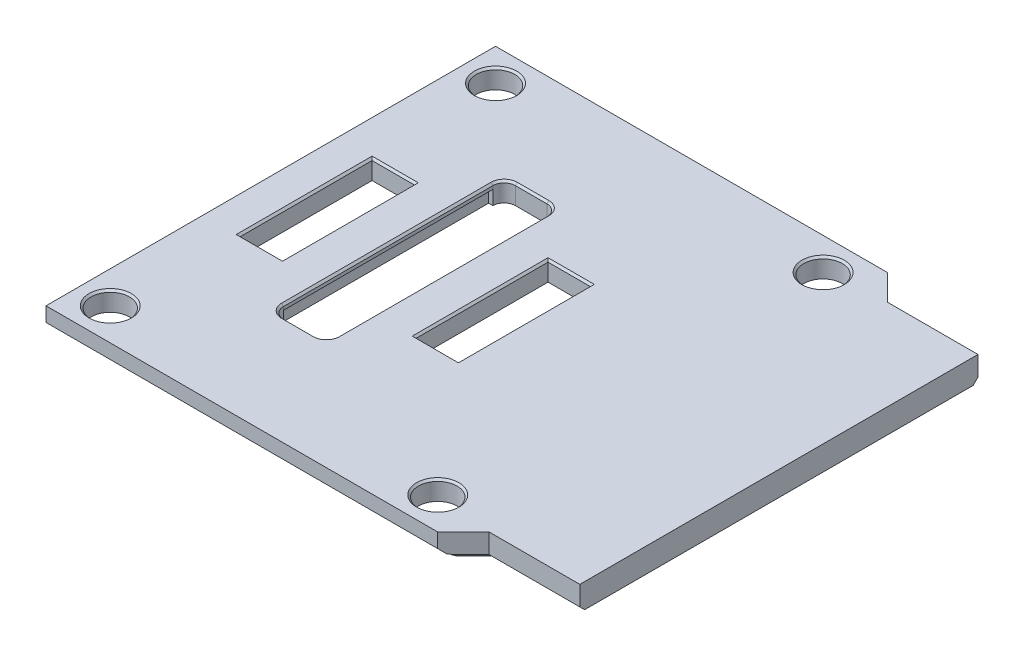
from build123d import *

# Parameters (mm, degrees)
SKETCH21_R          = 3
SKETCH21_W          = 6.6
SKETCH21_H          = 20.55
BOSS_EXTRUDE3_DEPTH = 3
BOSS_EXTRUDE2_DEPTH = 0.8
CUT_EXTRUDE1_DEPTH  = 2.2
CUT_EXTRUDE2_DEPTH  = 1
CHAMFER1_SIZE       = 0.3
CHAMFER2_SIZE       = 0.75


with BuildPart() as part:
    # Sketch21 → Boss-Extrude3 (new body)
    with BuildSketch(Plane(origin=(0, 0, 0), x_dir=(1, 0, 0), z_dir=(0, 1, 0))):
        Polygon((38.5, 35), (-22.5, 35), (-22.5, -35), (38.5, -35), (42.5, -31), (56.625, -31), (56.625, 31), (42.5, 31), align=None)
        with Locations(Location((-17.5, 30, 0), (0, 0, 270))):
            Circle(SKETCH21_R, mode=Mode.SUBTRACT)
        with Locations(Location((-17.5, -30, 0), (0, 0, 270))):
            Circle(SKETCH21_R, mode=Mode.SUBTRACT)
        with Locations(Location((33.5, -30, 0), (0, 0, 270))):
            Circle(SKETCH21_R, mode=Mode.SUBTRACT)
        with Locations(Location((33.5, 30, 0), (0, 0, 270))):
            Circle(SKETCH21_R, mode=Mode.SUBTRACT)
        with Locations((-13.7, 0)):
            Rectangle(SKETCH21_W, SKETCH21_H, mode=Mode.SUBTRACT)
        with BuildLine():
            Line((-4.21, 16.3), (-4.21, -16.3))
            ThreePointArc((-4.21, -16.3), (-3.697436867, -17.537436867), (-2.46, -18.05))
            Line((-2.46, -18.05), (2.46, -18.05))
            ThreePointArc((2.46, -18.05), (3.697436867, -17.537436867), (4.21, -16.3))
            Line((4.21, -16.3), (4.21, 16.3))
            ThreePointArc((4.21, 16.3), (3.697436867, 17.537436867), (2.46, 18.05))
            Line((2.46, 18.05), (-2.46, 18.05))
            ThreePointArc((-2.46, 18.05), (-3.697436867, 17.537436867), (-4.21, 16.3))
        make_face(mode=Mode.SUBTRACT)
        with Locations((13.7, 0)):
            Rectangle(SKETCH21_W, SKETCH21_H, mode=Mode.SUBTRACT)
    extrude(amount=BOSS_EXTRUDE3_DEPTH)

    # Sketch28 → Boss-Extrude2 (add)
    with BuildSketch(Plane.XZ):
        Polygon((39.5, 34), (39.5, -34), (42.5, -31), (56.625, -31), (56.625, 31), (42.5, 31), align=None)
    extrude(amount=BOSS_EXTRUDE2_DEPTH)

    # Sketch29 → Cut-Extrude1 (cut)
    with BuildSketch(Plane.XZ):
        Polygon((-4.21, 16.3), (-4.875, 16.3), (-4.875, -16.3), (-4.21, -16.3), (4.21, -16.3), (4.875, -16.3), (4.875, 16.3), (4.21, 16.3), align=None)
    extrude(amount=-CUT_EXTRUDE1_DEPTH, mode=Mode.SUBTRACT)

    # Sketch30 → Cut-Extrude2 (cut)
    # profile 1 of 4: a face of its own
    with BuildSketch(Plane.XZ):
        Polygon((30, -6.084415584), (30, -7.123376623), (23.194805195, -7.123376623), (30, -9.358766234), (30, -10.290584416), (23.194805195, -12.525974026), (30, -12.525974026), (30, -13.564935065), (22, -13.564935065), (22, -11.939935065), (28.668831169, -9.829545455), (22, -7.709415584), (22, -6.084415584), align=None)
    # profile 2 of 4: a face of its own
    with BuildSketch(Plane.XZ):
        with BuildLine():
            add(Edge.make_bspline(
                [(30.103896104, -2.298701299), (30.103067309, -2.395623244), (30.101458149, -2.583803562), (30.077120757, -2.856806977), (30.043441513, -3.112684332), (29.990720477, -3.349454628), (29.92681865, -3.569556735), (29.84494459, -3.770560491), (29.751676383, -3.9562646), (29.640184851, -4.121871579), (29.516615752, -4.272075178), (29.375879847, -4.401668661), (29.221972567, -4.515692158), (29.052257996, -4.609156913), (28.868514081, -4.686592109), (28.670085387, -4.743928609), (28.457107647, -4.785605452), (28.309709631, -4.797462408), (28.233766234, -4.803571429)],
                knots=[0, 0, 0, 0, 1.318794478, 2.560526035, 3.728243692, 4.829167506, 5.859211314, 6.844017696, 7.77958115, 8.682536498, 9.55583357, 10.420985288, 11.279874663, 12.156984126, 13.05163966, 13.988564904, 14.963654886, 16, 16, 16, 16], degree=3))
            Line((28.233766234, -4.803571429), (28.233766234, -3.76461039))
            add(Edge.make_bspline(
                [(28.233766234, -3.76461039), (28.276082816, -3.763564761), (28.357947694, -3.761541907), (28.476134337, -3.740166384), (28.586751637, -3.712672627), (28.688349357, -3.67036585), (28.783864525, -3.621500377), (28.868666466, -3.555998852), (28.946860594, -3.482137003), (29.015350514, -3.395594265), (29.078413582, -3.299861025), (29.128391442, -3.189971645), (29.17548457, -3.07144951), (29.209220227, -2.940779669), (29.240159157, -2.800318747), (29.257500765, -2.647495072), (29.271994968, -2.484042329), (29.272478757, -2.371250975), (29.272727273, -2.313311688)],
                knots=[0, 0, 0, 0, 1.000573209, 1.935690443, 2.836843993, 3.693268586, 4.535782358, 5.368499125, 6.220215677, 7.076544447, 7.975601122, 8.926814499, 9.928453325, 10.991382637, 12.117004715, 13.331014315, 14.628980654, 16, 16, 16, 16], degree=3))
            add(Edge.make_bspline(
                [(29.272727273, -2.313311688), (29.272477286, -2.261323175), (29.271992064, -2.160413873), (29.25754424, -2.01369465), (29.239472891, -1.876258483), (29.21132631, -1.748275466), (29.176555316, -1.630075024), (29.131923796, -1.521611339), (29.080501402, -1.422166793), (29.001941506, -1.306296479), (28.891278773, -1.182718379), (28.73659228, -1.072587187), (28.562614518, -1.00468464), (28.440535545, -0.997283039), (28.378246753, -0.993506494)],
                knots=[0, 0, 0, 0, 1.049722362, 2.037502948, 2.975957546, 3.848689641, 4.682196446, 5.461765277, 6.214820971, 6.939488855, 8.285974658, 9.541612251, 10.745648019, 12, 12, 12, 12], degree=3))
            add(Edge.make_bspline(
                [(28.378246753, -0.993506494), (28.346763417, -0.994183282), (28.285509435, -0.995500043), (28.198094752, -1.013038493), (28.116989153, -1.036078954), (28.043895516, -1.073277175), (27.978132386, -1.120152847), (27.91781187, -1.175968403), (27.867975971, -1.243948686), (27.822461309, -1.322779364), (27.783044583, -1.418968765), (27.736245211, -1.532239323), (27.690729471, -1.668941517), (27.640192756, -1.826342557), (27.586743359, -2.005529733), (27.52981461, -2.206135721), (27.472099938, -2.429578583), (27.410484723, -2.667825675), (27.348547139, -2.908916775), (27.281606559, -3.138344652), (27.213843382, -3.35068402), (27.144538665, -3.546605107), (27.071027512, -3.724150567), (26.999273376, -3.886230737), (26.921988655, -4.029162978), (26.844897165, -4.158210405), (26.757806858, -4.271639817), (26.655650322, -4.368805026), (26.538272332, -4.449974022), (26.405573224, -4.515399248), (26.259022178, -4.567101625), (26.096859779, -4.604654298), (25.919870357, -4.624614358), (25.797123614, -4.628080852), (25.733766234, -4.62987013)],
                knots=[0, 0, 0, 0, 0.609469888, 1.185784659, 1.72354831, 2.239788445, 2.766795736, 3.28643782, 3.825837257, 4.394650866, 5.047817349, 5.838989728, 6.771546224, 7.840191231, 9.04536596, 10.397473415, 11.883969141, 13.520573579, 15.169980156, 16.710930355, 18.154580726, 19.492276644, 20.739482987, 21.88068629, 22.927624582, 23.888735019, 24.79347993, 25.691627909, 26.611521855, 27.550140283, 28.552530272, 29.619112255, 30.771072804, 32, 32, 32, 32], degree=3))
            add(Edge.make_bspline(
                [(25.733766234, -4.62987013), (25.67520802, -4.627970482), (25.560134212, -4.62423745), (25.391367911, -4.595537471), (25.230466456, -4.550698077), (25.077097455, -4.486528081), (24.932327589, -4.402583067), (24.793763605, -4.302331737), (24.665049855, -4.181655436), (24.543482, -4.046039193), (24.43312437, -3.894260688), (24.339684079, -3.727132066), (24.257615927, -3.549505201), (24.190985373, -3.359321562), (24.141623211, -3.156271887), (24.103560771, -2.942230454), (24.083220864, -2.715216877), (24.079718791, -2.560100694), (24.077922078, -2.480519481)],
                knots=[0, 0, 0, 0, 0.925490325, 1.81869781, 2.698985002, 3.561843198, 4.439506826, 5.339694674, 6.260029024, 7.223537863, 8.216200057, 9.220155366, 10.24621711, 11.306974059, 12.400590692, 13.547020494, 14.741516967, 16, 16, 16, 16], degree=3))
            add(Edge.make_bspline(
                [(24.077922078, -2.480519481), (24.079100785, -2.389033894), (24.081391296, -2.211255453), (24.100967879, -1.95323672), (24.133116756, -1.711952726), (24.17768197, -1.488210503), (24.236413566, -1.281944584), (24.307185153, -1.093035368), (24.392098481, -0.921208329), (24.489260392, -0.766089492), (24.600165531, -0.628414151), (24.72493983, -0.508947344), (24.86185203, -0.405701135), (25.012592849, -0.320870627), (25.17622274, -0.25389912), (25.353001809, -0.206065737), (25.542097394, -0.172474188), (25.673013023, -0.165777509), (25.74025974, -0.162337662)],
                knots=[0, 0, 0, 0, 1.35942475, 2.641688414, 3.842675212, 4.97503988, 6.028837698, 7.026524857, 7.968775207, 8.872346758, 9.741443809, 10.588878301, 11.433254833, 12.283089724, 13.152223979, 14.05361, 15.000208458, 16, 16, 16, 16], degree=3))
            Line((25.74025974, -0.162337662), (25.74025974, -1.201298701))
            add(Edge.make_bspline(
                [(25.74025974, -1.201298701), (25.674721832, -1.208715551), (25.549076856, -1.222934647), (25.375375364, -1.289794963), (25.22801032, -1.391278982), (25.108112126, -1.529254824), (25.017480494, -1.70236831), (24.95378105, -1.908593969), (24.915339674, -2.147931329), (24.911256881, -2.318566714), (24.909090909, -2.409090909)],
                knots=[0, 0, 0, 0, 0.958885329, 1.838312007, 2.683388096, 3.544636038, 4.476874501, 5.512704297, 6.680458674, 8, 8, 8, 8], degree=3))
            add(Edge.make_bspline(
                [(24.909090909, -2.409090909), (24.910895743, -2.490953805), (24.914357274, -2.647960509), (24.950990134, -2.872453696), (25.008423519, -3.075331214), (25.076523787, -3.227354018), (25.141975259, -3.334516311), (25.197828471, -3.402415345), (25.256998255, -3.462751797), (25.325503304, -3.506899846), (25.395422474, -3.546527148), (25.472769579, -3.571306954), (25.554938786, -3.588887883), (25.61190975, -3.590222262), (25.641233766, -3.590909091)],
                knots=[0, 0, 0, 0, 1.898886608, 3.641917703, 5.263913708, 6.781775949, 7.492829293, 8.171637923, 8.820129793, 9.443813489, 10.056392137, 10.680075833, 11.320610447, 12, 12, 12, 12], degree=3))
            add(Edge.make_bspline(
                [(25.641233766, -3.590909091), (25.693601745, -3.588173991), (25.793343993, -3.582964606), (25.932521067, -3.532755637), (26.046460672, -3.446847813), (26.120477608, -3.347186421), (26.16971367, -3.244863761), (26.211505197, -3.142238609), (26.256566207, -3.015362815), (26.304827388, -2.864194696), (26.357408524, -2.688599575), (26.409102043, -2.487553747), (26.469062821, -2.262972788), (26.527292162, -2.019674479), (26.590317686, -1.7725332), (26.656464534, -1.535158817), (26.725715485, -1.314577671), (26.79891335, -1.111735187), (26.873636009, -0.925204125), (26.951004783, -0.755596696), (27.03015641, -0.602152272), (27.113523202, -0.464723076), (27.205414194, -0.342175865), (27.315001132, -0.238929071), (27.438169167, -0.150181539), (27.576625602, -0.076808805), (27.731509238, -0.021618552), (27.901145757, 0.016112898), (28.08529053, 0.041358551), (28.213113542, 0.044058296), (28.279220779, 0.045454545)],
                knots=[0, 0, 0, 0, 0.886876726, 1.689182582, 2.470212093, 3.276978007, 3.770089089, 4.396329915, 5.157818963, 6.055717916, 7.090729244, 8.269771542, 9.580232216, 11.037716353, 12.51750611, 13.910932755, 15.221554488, 16.442288017, 17.571848501, 18.632682187, 19.606715272, 20.501836021, 21.360120455, 22.198499933, 23.047686038, 23.931415603, 24.849906235, 25.830634081, 26.878051879, 28, 28, 28, 28], degree=3))
            add(Edge.make_bspline(
                [(28.279220779, 0.045454545), (28.34371882, 0.043630808), (28.470156379, 0.040055678), (28.655638898, 0.010463378), (28.832279264, -0.040858624), (29.001301578, -0.109714297), (29.160557988, -0.201265786), (29.312612514, -0.310219714), (29.455421384, -0.440819067), (29.587891688, -0.590437305), (29.709455888, -0.755056432), (29.815732766, -0.934994432), (29.904732119, -1.128858396), (29.978152624, -1.336386007), (30.034513409, -1.557599571), (30.074835203, -1.792625486), (30.099493407, -2.041138559), (30.10240589, -2.211522119), (30.103896104, -2.298701299)],
                knots=[0, 0, 0, 0, 0.930697296, 1.824475469, 2.702134557, 3.581182897, 4.452177757, 5.347490549, 6.276448989, 7.239081344, 8.228006388, 9.226020669, 10.250015029, 11.302452558, 12.399371731, 13.540990107, 14.741812496, 16, 16, 16, 16], degree=3))
        make_face()
    # profile 3 of 4: a face of its own
    with BuildSketch(Plane.XZ):
        with BuildLine():
            add(Edge.make_bspline(
                [(25.196428571, 2.332792208), (25.157055554, 2.382974774), (25.078640032, 2.482918653), (24.977939773, 2.645173305), (24.891152156, 2.815904453), (24.821831827, 2.996168251), (24.768019094, 3.184764495), (24.728848381, 3.381766925), (24.706249319, 3.588216661), (24.702967117, 3.728841786), (24.701298701, 3.800324675)],
                knots=[0, 0, 0, 0, 0.967432277, 1.926743552, 2.892675798, 3.870267945, 4.852814835, 5.865879806, 6.915179084, 8, 8, 8, 8], degree=3))
            add(Edge.make_bspline(
                [(24.701298701, 3.800324675), (24.703563129, 3.881058436), (24.708034569, 4.04047894), (24.741230486, 4.276028237), (24.796337503, 4.5032459), (24.873266474, 4.723087096), (24.972440607, 4.934018085), (25.093888362, 5.137266498), (25.237518365, 5.331740896), (25.399769086, 5.518271099), (25.582764557, 5.687001357), (25.779346309, 5.839032321), (25.994038689, 5.962802723), (26.220737112, 6.068995757), (26.463759575, 6.147305669), (26.720761753, 6.204418965), (26.992029884, 6.238872465), (27.177930141, 6.243016619), (27.272727273, 6.24512987)],
                knots=[0, 0, 0, 0, 0.976972944, 1.929174593, 2.872777695, 3.80284985, 4.743379281, 5.689162028, 6.663805022, 7.666263974, 8.676566079, 9.672133131, 10.667376965, 11.669643332, 12.696956219, 13.750492063, 14.852896154, 16, 16, 16, 16], degree=3))
            add(Edge.make_bspline(
                [(27.272727273, 6.24512987), (27.372384544, 6.242968161), (27.56851036, 6.23871391), (27.856081497, 6.20458936), (28.130345661, 6.145831052), (28.391358065, 6.064675449), (28.6392502, 5.960290907), (28.874731804, 5.833380633), (29.095915293, 5.681164818), (29.303241216, 5.508560749), (29.49094159, 5.315978982), (29.656107564, 5.107601247), (29.795515208, 4.88343808), (29.907747413, 4.642787034), (29.995291092, 4.38689167), (30.05873332, 4.116183806), (30.096457588, 3.830068071), (30.101377297, 3.634313772), (30.103896104, 3.534090909)],
                knots=[0, 0, 0, 0, 1.085861201, 2.136978174, 3.150190858, 4.138733941, 5.111317432, 6.077083246, 7.048682929, 8.032518342, 9.012528758, 9.974054186, 10.924831911, 11.88246139, 12.861548741, 13.867130159, 14.908007008, 16, 16, 16, 16], degree=3))
            add(Edge.make_bspline(
                [(30.103896104, 3.534090909), (30.101751534, 3.451787378), (30.097522312, 3.289479878), (30.072245084, 3.050299943), (30.025485968, 2.820575556), (29.965123269, 2.598800204), (29.883110281, 2.387188976), (29.783482599, 2.184693669), (29.666344126, 1.99120498), (29.532309413, 1.807585193), (29.379678975, 1.638685125), (29.209492939, 1.485954449), (29.021142247, 1.352793472), (28.814111947, 1.240408433), (28.590536057, 1.146160265), (28.349344421, 1.069962076), (28.090196015, 1.012558983), (27.910420049, 0.991383866), (27.818181818, 0.980519481)],
                knots=[0, 0, 0, 0, 1.037667412, 2.046342376, 3.026947607, 3.99019774, 4.940315345, 5.882984018, 6.831753852, 7.788168383, 8.744436945, 9.696144912, 10.665174598, 11.645115268, 12.659953086, 13.719211991, 14.829788793, 16, 16, 16, 16], degree=3))
            Line((27.818181818, 0.980519481), (27.818181818, 2.019480519))
            add(Edge.make_bspline(
                [(27.818181818, 2.019480519), (27.877850113, 2.027849738), (27.994093999, 2.044154385), (28.161186309, 2.081705555), (28.316907726, 2.128212171), (28.459962909, 2.187263598), (28.592524549, 2.254572669), (28.711542941, 2.335200648), (28.819521904, 2.424657487), (28.915394841, 2.524134003), (28.999906491, 2.631495375), (29.072914947, 2.74531682), (29.13496845, 2.864272867), (29.185432947, 2.988199815), (29.224707235, 3.116982335), (29.25163716, 3.25132011), (29.270917151, 3.390677608), (29.272118544, 3.485862248), (29.272727273, 3.534090909)],
                knots=[0, 0, 0, 0, 1.241156875, 2.417982611, 3.525572816, 4.58578494, 5.60320588, 6.583594582, 7.541596003, 8.487909663, 9.424847767, 10.352784656, 11.270481184, 12.185735582, 13.106408138, 14.04022233, 15.007009384, 16, 16, 16, 16], degree=3))
            add(Edge.make_bspline(
                [(29.272727273, 3.534090909), (29.271339843, 3.594791616), (29.26861352, 3.714069589), (29.242077028, 3.888335719), (29.198214168, 4.053943445), (29.136195344, 4.210105321), (29.057577844, 4.357887375), (28.961437073, 4.49654939), (28.84632936, 4.625488416), (28.715397616, 4.744687878), (28.571978869, 4.852066576), (28.42000248, 4.947879936), (28.258332779, 5.026622934), (28.08957943, 5.094284443), (27.911447154, 5.144236212), (27.725620634, 5.179170243), (27.532025877, 5.203520656), (27.399969394, 5.205275925), (27.332792208, 5.206168831)],
                knots=[0, 0, 0, 0, 1.016080181, 1.996615692, 2.944134192, 3.879876401, 4.804314401, 5.742073392, 6.698693939, 7.693038145, 8.702671078, 9.696023502, 10.697159615, 11.71032537, 12.737380959, 13.789639752, 14.875588847, 16, 16, 16, 16], degree=3))
            add(Edge.make_bspline(
                [(27.332792208, 5.206168831), (27.265072376, 5.20529079), (27.132471854, 5.203571519), (26.939401041, 5.179356903), (26.757134743, 5.144952202), (26.585698717, 5.094040967), (26.426011136, 5.027730354), (26.27651617, 4.947917204), (26.139117332, 4.852690989), (26.01314256, 4.744217982), (25.89901073, 4.62471489), (25.802122889, 4.493971041), (25.717898464, 4.356463002), (25.649134521, 4.209676474), (25.598049532, 4.053473252), (25.560283269, 3.889440266), (25.537293176, 3.717097773), (25.534096567, 3.599096205), (25.532467532, 3.538961039)],
                knots=[0, 0, 0, 0, 1.174140589, 2.299055552, 3.37064078, 4.389478889, 5.395475724, 6.365793819, 7.324138425, 8.289493223, 9.245812312, 10.184644224, 11.107234683, 12.039660683, 12.989691782, 13.953035803, 14.95683987, 16, 16, 16, 16], degree=3))
            add(Edge.make_bspline(
                [(25.532467532, 3.538961039), (25.53458077, 3.469552279), (25.538751008, 3.332581883), (25.57403365, 3.131482346), (25.630870364, 2.938500675), (25.711180045, 2.753776927), (25.814317042, 2.577332966), (25.940571394, 2.409546562), (26.088781471, 2.24915104), (26.201855833, 2.15307754), (26.25974026, 2.103896104)],
                knots=[0, 0, 0, 0, 0.998714719, 1.970851397, 2.929755122, 3.889323247, 4.86342469, 5.865325013, 6.907228509, 8, 8, 8, 8], degree=3))
            Line((26.25974026, 2.103896104), (26.25974026, 1.292207792))
            Line((26.25974026, 1.292207792), (22, 1.603896104))
            Line((22, 1.603896104), (22, 5.863636364))
            Line((22, 5.863636364), (22.935064935, 5.863636364))
            Line((22.935064935, 5.863636364), (22.935064935, 2.5))
            Line((22.935064935, 2.5), (25.196428571, 2.332792208))
        make_face()
    # profile 4 of 4: a face of its own
    with BuildSketch(Plane.XZ):
        with BuildLine():
            add(Edge.make_bspline(
                [(24.878246753, 8.461038961), (24.814187466, 8.518718223), (24.688796852, 8.631620481), (24.52623408, 8.819626512), (24.38902696, 9.016006238), (24.274055052, 9.219122635), (24.185259096, 9.432124103), (24.124260188, 9.654220452), (24.085370567, 9.885004196), (24.080429628, 10.042051167), (24.077922078, 10.121753247)],
                knots=[0, 0, 0, 0, 1.085250411, 2.124285525, 3.122966424, 4.099740098, 5.059495047, 6.022248179, 6.996281616, 8, 8, 8, 8], degree=3))
            add(Edge.make_bspline(
                [(24.077922078, 10.121753247), (24.080388406, 10.21442069), (24.085197844, 10.395125927), (24.123411532, 10.657861469), (24.184306732, 10.904870872), (24.272255, 11.135752436), (24.387153957, 11.349110858), (24.524114245, 11.548005833), (24.688142408, 11.729328525), (24.877058745, 11.892596956), (25.086654972, 12.038797969), (25.315305287, 12.164833525), (25.559504609, 12.274982728), (25.822560693, 12.361856011), (26.102716801, 12.430025074), (26.400708473, 12.478028939), (26.715845271, 12.507721006), (26.931750621, 12.511204737), (27.042207792, 12.512987013)],
                knots=[0, 0, 0, 0, 1.032558834, 2.013531219, 2.952724632, 3.863440268, 4.759334089, 5.647806176, 6.548963813, 7.476698465, 8.425450168, 9.392113565, 10.383030705, 11.407311388, 12.475256329, 13.593801989, 14.76898917, 16, 16, 16, 16], degree=3))
            add(Edge.make_bspline(
                [(27.042207792, 12.512987013), (27.157541132, 12.510763865), (27.382188592, 12.506433594), (27.709535495, 12.474051549), (28.017782216, 12.418849126), (28.307815796, 12.342667109), (28.580203904, 12.246008442), (28.833597649, 12.125035021), (29.068200596, 11.982093506), (29.282094588, 11.81769338), (29.474911402, 11.638602071), (29.643383348, 11.446244921), (29.785901829, 11.242265117), (29.901915152, 11.025799081), (29.993700364, 10.798532687), (30.0563313, 10.558394628), (30.096796644, 10.308192264), (30.101508048, 10.137064002), (30.103896104, 10.050324675)],
                knots=[0, 0, 0, 0, 1.255961248, 2.446374192, 3.578096896, 4.663065679, 5.708848904, 6.721082169, 7.715645011, 8.695165174, 9.654207175, 10.577283402, 11.474815653, 12.358130333, 13.246756847, 14.137354944, 15.05588606, 16, 16, 16, 16], degree=3))
            add(Edge.make_bspline(
                [(30.103896104, 10.050324675), (30.101957507, 9.973402044), (30.098135909, 9.821762811), (30.06994442, 9.59904847), (30.024642656, 9.385538268), (29.961678515, 9.181233999), (29.877748249, 8.987089156), (29.776994728, 8.801656094), (29.658183542, 8.624227831), (29.565007665, 8.515871412), (29.517857143, 8.461038961)],
                knots=[0, 0, 0, 0, 1.064402764, 2.098279994, 3.101513528, 4.082158303, 5.051759688, 6.023614418, 6.999874063, 8, 8, 8, 8], degree=3))
            Line((29.517857143, 8.461038961), (32.285714286, 8.461038961))
            Line((32.285714286, 8.461038961), (32.285714286, 7.422077922))
            Line((32.285714286, 7.422077922), (24.181818182, 7.422077922))
            Line((24.181818182, 7.422077922), (24.181818182, 8.461038961))
            Line((24.181818182, 8.461038961), (24.878246753, 8.461038961))
        make_face()
        with BuildLine():
            add(Edge.make_bspline(
                [(28.582792208, 8.461038961), (28.638068094, 8.516806457), (28.746272219, 8.625972921), (28.88604868, 8.80468271), (29.005525826, 8.988624463), (29.10353432, 9.178758798), (29.178838914, 9.375397967), (29.232421931, 9.577816102), (29.266023104, 9.786763726), (29.270477616, 9.928446258), (29.272727273, 10)],
                knots=[0, 0, 0, 0, 1.085707992, 2.125304366, 3.132607823, 4.117140125, 5.079411284, 6.040195589, 7.010242569, 8, 8, 8, 8], degree=3))
            add(Edge.make_bspline(
                [(29.272727273, 10), (29.271564887, 10.055333141), (29.269292802, 10.163491349), (29.239839848, 10.320741082), (29.196497459, 10.46900301), (29.136257851, 10.609490038), (29.055236931, 10.73925618), (28.959450301, 10.86231131), (28.844022134, 10.974748696), (28.712202831, 11.078371652), (28.563994598, 11.173419787), (28.397122683, 11.254505361), (28.212848364, 11.321562178), (28.013017105, 11.379403423), (27.794752168, 11.419663171), (27.5604292, 11.453303498), (27.308137994, 11.469921857), (27.134757703, 11.472630718), (27.045454545, 11.474025974)],
                knots=[0, 0, 0, 0, 0.883090077, 1.726152498, 2.546968976, 3.348612605, 4.159853212, 4.985030933, 5.834983544, 6.727674538, 7.660828743, 8.643132597, 9.685597177, 10.791445765, 11.963314957, 13.229053737, 14.572765964, 16, 16, 16, 16], degree=3))
            add(Edge.make_bspline(
                [(27.045454545, 11.474025974), (26.960488256, 11.472475312), (26.795809545, 11.469469872), (26.556459939, 11.455037872), (26.334057605, 11.422691005), (26.126274149, 11.383838663), (25.935303572, 11.329227501), (25.757782142, 11.267878791), (25.598800519, 11.188161553), (25.452904693, 11.101577669), (25.325039242, 11.002172732), (25.21216834, 10.89471845), (25.119935221, 10.774953005), (25.042443311, 10.64727479), (24.981985433, 10.510401495), (24.939903278, 10.363480785), (24.913104526, 10.207694614), (24.91044575, 10.100220469), (24.909090909, 10.045454545)],
                knots=[0, 0, 0, 0, 1.408584611, 2.730069766, 3.970578609, 5.131496849, 6.230442265, 7.260312358, 8.239039861, 9.17271741, 10.067908288, 10.917833178, 11.748516327, 12.565283383, 13.388525032, 14.22012764, 15.093025089, 16, 16, 16, 16], degree=3))
            add(Edge.make_bspline(
                [(24.909090909, 10.045454545), (24.911597622, 9.973740048), (24.91662789, 9.829829249), (24.967176055, 9.618412528), (25.041627812, 9.410177473), (25.150533213, 9.209114776), (25.288800898, 9.011868337), (25.4585467, 8.821890573), (25.656752375, 8.634221833), (25.805680198, 8.520282822), (25.883116883, 8.461038961)],
                knots=[0, 0, 0, 0, 0.889314606, 1.784603949, 2.686204335, 3.630395475, 4.614970347, 5.672211878, 6.789640565, 8, 8, 8, 8], degree=3))
            Line((25.883116883, 8.461038961), (28.582792208, 8.461038961))
        make_face(mode=Mode.SUBTRACT)
    extrude(amount=-CUT_EXTRUDE2_DEPTH, mode=Mode.SUBTRACT)

    # Chamfer1
    chamfer1_edges = [part.edges().sort_by_distance(p)[0] for p in [
        (-17.5, 3, -33),
        (-17.5, 3, 27),
        (33.5, 3, 27),
        (33.5, 3, -33),
        (-13.7, 3, 10.275),
        (-10.4, 3, 0),
        (-13.7, 3, -10.275),
        (-17, 3, 0),
        (-3.697436867, 3, -17.537436867),
        (-4.21, 3, 0),
        (-3.697436867, 3, 17.537436867),
        (0, 3, 18.05),
        (3.697436867, 3, 17.537436867),
        (4.21, 3, 0),
        (3.697436867, 3, -17.537436867),
        (0, 3, -18.05),
        (17, 3, 0),
        (13.7, 3, -10.275),
        (10.4, 3, 0),
        (13.7, 3, 10.275),
    ]]
    chamfer(chamfer1_edges, length=CHAMFER1_SIZE)

    # Chamfer2
    chamfer2_edges = [part.edges().sort_by_distance(p)[0] for p in [
        (8, 0, 35),
        (-22.5, 0, 0),
        (41, -0.8, -32.5),
        (49.5625, -0.8, -31),
        (49.5625, -0.8, 31),
        (41, -0.8, 32.5),
        (8, 0, -35),
    ]]
    chamfer(chamfer2_edges, length=CHAMFER2_SIZE)


solid = part.part
